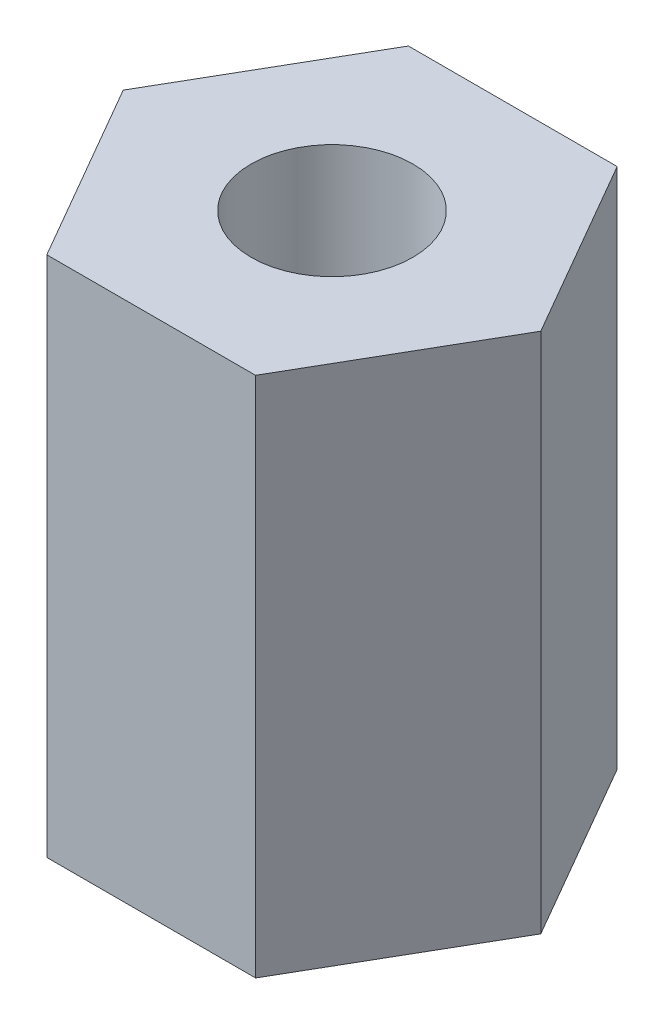
from build123d import *

# Parameters (mm, degrees)
SKETCH_1_R      = 1.55
EXTRUDE_1_DEPTH = 10


with BuildPart() as part:
    # 草圖1 → 填料-伸長1 (new body)
    with BuildSketch(Plane(origin=(0, 0, 0), x_dir=(1, 0, 0), z_dir=(0, 1, 0))):
        Polygon((2, 3.464101615), (-2, 3.464101615), (-4, 0), (-2, -3.464101615), (2, -3.464101615), (4, 0), align=None)
        with Locations(Location((0, 0, 0), (0, 0, 270))):
            Circle(SKETCH_1_R, mode=Mode.SUBTRACT)
    extrude(amount=EXTRUDE_1_DEPTH)


solid = part.part
